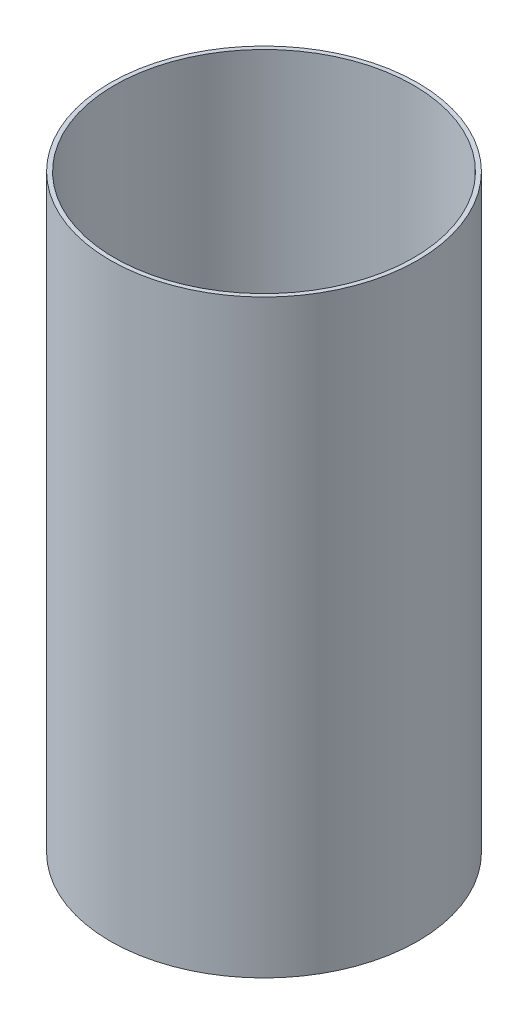
from build123d import *


with BuildPart() as part:
    # Schizzo1 → Rivoluzione1 (revolve)
    with BuildSketch(Plane.XY, mode=Mode.PRIVATE) as rivoluzione1_sk:
        Polygon((-72, 0), (-72, 3), (-71, 3), (-71, 280), (-73, 280), (-73, 0), align=None)
    revolve(rivoluzione1_sk.sketch.rotate(Axis((0, 0, 0), (0, 1, 0)), 270), axis=Axis((0, 0, 0), (0, 1, 0)))


solid = part.part
